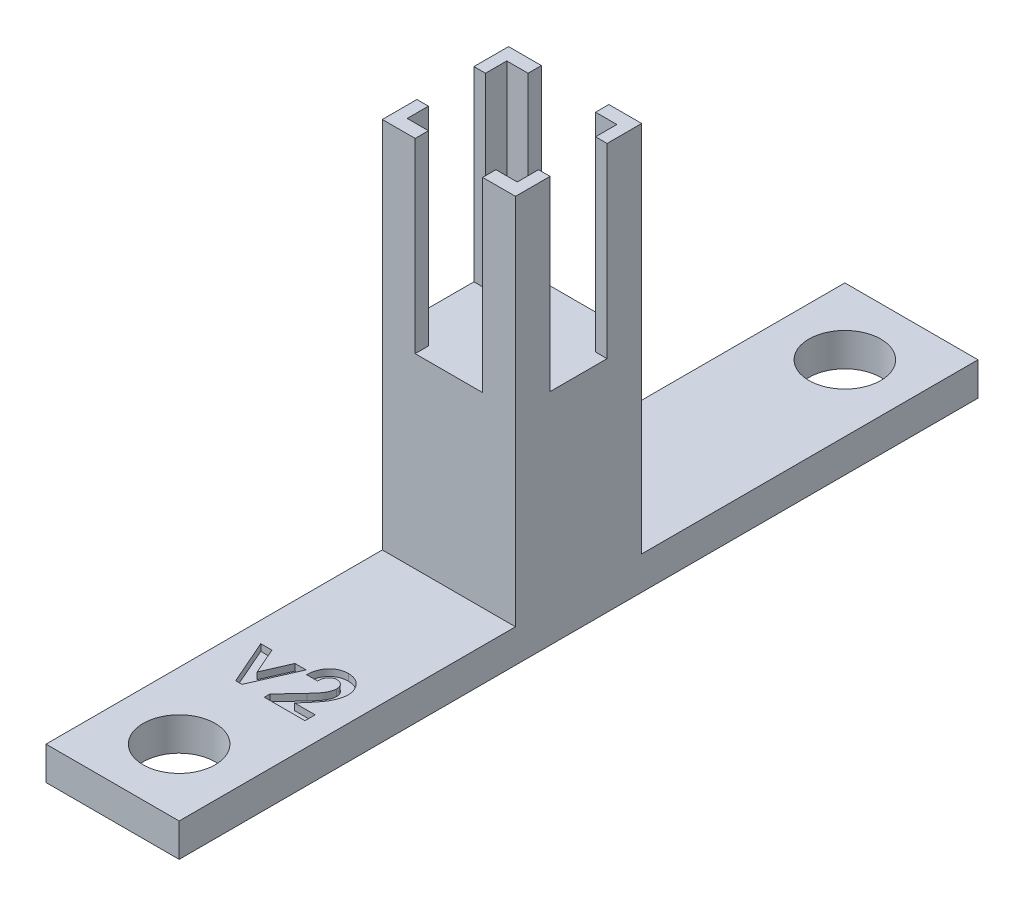
from build123d import *

# Parameters (mm, degrees)
BOSS_EXTRUDE1_DEPTH   = 17.78
BOSS_EXTRUDE1_2_DEPTH = 17.78
BOSS_EXTRUDE1_3_DEPTH = 17.78
BOSS_EXTRUDE1_4_DEPTH = 17.78
SKETCH2_W             = 13.04
SKETCH2_H             = 12.04
BOSS_EXTRUDE2_DEPTH   = 17.78
SKETCH3_W             = 12.7
SKETCH3_H             = 76.2
SKETCH3_R             = 3.429
BOSS_EXTRUDE3_DEPTH   = 3.175
SKETCH4_OUTSIDE_W     = 32.334
SKETCH4_OUTSIDE_H     = 95.494
SKETCH4_OUTSIDE_W_2   = 12.7
SKETCH4_OUTSIDE_H_2   = 76.2
CUT_EXTRUDE2_DEPTH    = 55.722213268
CUT_EXTRUDE3_DEPTH    = 0.635


with BuildPart() as part:
    # Sketch1 → Boss-Extrude1 (new body)
    with BuildSketch(Plane(origin=(0, 0, 0), x_dir=(1, 0, 0), z_dir=(0, 1, 0))):
        Polygon((-5.25, 4.75), (-5.25, 2.718), (-6.52, 2.718), (-6.52, 6.02), (-3.218, 6.02), (-3.218, 4.75), align=None)
    extrude(amount=BOSS_EXTRUDE1_DEPTH)



with BuildPart() as body_2:
    # Sketch1 → Boss-Extrude1 2 (new body)
    with BuildSketch(Plane(origin=(0, 0, 0), x_dir=(1, 0, 0), z_dir=(0, 1, 0))):
        Polygon((6.52, 2.718), (6.52, 6.02), (3.218, 6.02), (3.218, 4.75), (5.25, 4.75), (5.25, 2.718), align=None)
    extrude(amount=BOSS_EXTRUDE1_2_DEPTH)


with BuildPart() as body_3:
    # Sketch1 → Boss-Extrude1 3 (new body)
    with BuildSketch(Plane(origin=(0, 0, 0), x_dir=(1, 0, 0), z_dir=(0, 1, 0))):
        Polygon((5.25, -2.718), (6.52, -2.718), (6.52, -6.02), (3.218, -6.02), (3.218, -4.75), (5.25, -4.75), align=None)
    extrude(amount=BOSS_EXTRUDE1_3_DEPTH)


with BuildPart() as body_4:
    # Sketch1 → Boss-Extrude1 4 (new body)
    with BuildSketch(Plane(origin=(0, 0, 0), x_dir=(1, 0, 0), z_dir=(0, 1, 0))):
        Polygon((-5.25, -2.718), (-6.52, -2.718), (-6.52, -6.02), (-3.218, -6.02), (-3.218, -4.75), (-5.25, -4.75), align=None)
    extrude(amount=BOSS_EXTRUDE1_4_DEPTH)


with BuildPart() as part_1:
    add(part.part)

    add(body_2.part)  # Boss-Extrude2 merges body 2

    add(body_3.part)  # Boss-Extrude2 merges body 3

    add(body_4.part)  # Boss-Extrude2 merges body 4
    # Sketch2 → Boss-Extrude2 (add)
    with BuildSketch(Plane(origin=(0, 0, 0), x_dir=(-1, 0, 0), z_dir=(0, -1, 0))):
        Rectangle(SKETCH2_W, SKETCH2_H)
    extrude(amount=BOSS_EXTRUDE2_DEPTH)

    # Sketch3 → Boss-Extrude3 (add)
    with BuildSketch(Plane(origin=(0, -17.78, 0), x_dir=(-1, 0, 0), z_dir=(0, -1, 0))):
        Rectangle(SKETCH3_W, SKETCH3_H)
        with Locations(Location((0, 31.75, 0), (0, 0, 90))):
            Circle(SKETCH3_R, mode=Mode.SUBTRACT)
        with Locations(Location((0, -31.75, 0), (0, 0, 270))):
            Circle(SKETCH3_R, mode=Mode.SUBTRACT)
    extrude(amount=BOSS_EXTRUDE3_DEPTH)

    # Sketch4 outside → Cut-Extrude2 (cut, through all)
    with BuildSketch(Plane.XZ.offset(20.955)):
        Rectangle(SKETCH4_OUTSIDE_W, SKETCH4_OUTSIDE_H)
        Rectangle(SKETCH4_OUTSIDE_W_2, SKETCH4_OUTSIDE_H_2, mode=Mode.SUBTRACT)
    extrude(amount=-CUT_EXTRUDE2_DEPTH, mode=Mode.SUBTRACT)

    # Sketch5 → Cut-Extrude3 (cut)
    with BuildSketch(Plane(origin=(0, -17.78, 0), x_dir=(1, 0, 0), z_dir=(0, 1, 0))):
        Polygon((-4.402938034, -19.56265828), (-3.33951656, -19.56265828), (-2.238782051, -22.073125862), (-1.138047543, -19.56265828), (-0.074626068, -19.56265828), (-1.937945713, -23.816344178), (-2.539618389, -23.816344178), align=None)
        with BuildLine():
            Line((1.380582265, -19.935788622), (0.335817308, -19.935788622))
            add(Edge.make_bspline(
                [(0.335817308, -19.935788622), (0.340329487, -19.85675768), (0.349146015, -19.702335965), (0.384215936, -19.478033479), (0.431208425, -19.266092295), (0.493926141, -19.067253807), (0.572735055, -18.881590265), (0.665607209, -18.708468733), (0.774915278, -18.5488007), (0.898332826, -18.403356174), (1.033764562, -18.272876548), (1.17839879, -18.157185114), (1.334447887, -18.061719455), (1.499060707, -17.983160056), (1.672209219, -17.920394746), (1.855531682, -17.878431057), (2.04744079, -17.850012836), (2.178818114, -17.847526128), (2.245778245, -17.846258707)],
                knots=[0, 0, 0, 0, 1.199038563, 2.342849363, 3.436047546, 4.486744587, 5.497670872, 6.488682221, 7.459191391, 8.424610317, 9.374430501, 10.305433194, 11.225809216, 12.140057399, 13.06607119, 14.010487599, 14.985989317, 16, 16, 16, 16], degree=3))
            add(Edge.make_bspline(
                [(2.245778245, -17.846258707), (2.327970856, -17.848823334), (2.488430093, -17.853830085), (2.721590093, -17.896539334), (2.93933604, -17.967977154), (3.141509653, -18.067794628), (3.326389793, -18.194602266), (3.493945801, -18.34579962), (3.639110517, -18.52455889), (3.762804328, -18.723442196), (3.865579101, -18.934031626), (3.937599381, -19.151789829), (3.984937536, -19.370938387), (3.989986444, -19.518501933), (3.992494658, -19.591809088)],
                knots=[0, 0, 0, 0, 1.075374347, 2.099382735, 3.09057751, 4.06680945, 5.040638231, 6.016817125, 7.011024321, 8.044445721, 9.0776792, 10.070479129, 11.0414456, 12, 12, 12, 12], degree=3))
            add(Edge.make_bspline(
                [(3.992494658, -19.591809088), (3.991518092, -19.636150437), (3.989552505, -19.725398619), (3.97588552, -19.860453023), (3.955382341, -19.998021723), (3.924468545, -20.137986768), (3.885916506, -20.280387391), (3.839147311, -20.425649748), (3.783076101, -20.572950255), (3.718638592, -20.723946755), (3.641764481, -20.879129473), (3.552255264, -21.04082466), (3.447735164, -21.208888878), (3.329466651, -21.384271073), (3.196875325, -21.566694641), (3.049313917, -21.755610064), (2.888481989, -21.95168302), (2.774335046, -22.082746787), (2.715689269, -22.150083995)],
                knots=[0, 0, 0, 0, 0.728284026, 1.46585585, 2.227944881, 3.01186502, 3.81876927, 4.650621989, 5.517437689, 6.406905708, 7.346299482, 8.360816762, 9.441613733, 10.596154504, 11.834900912, 13.145207542, 14.533280747, 16, 16, 16, 16], degree=3))
            Line((2.715689269, -22.150083995), (2.108186432, -22.846205289))
            Line((2.108186432, -22.846205289), (4.067120726, -22.846205289))
            Line((4.067120726, -22.846205289), (4.067120726, -23.816344178))
            Line((4.067120726, -23.816344178), (0.186565171, -23.816344178))
            Line((0.186565171, -23.816344178), (0.186565171, -23.286965505))
            Line((0.186565171, -23.286965505), (1.909960938, -21.452796668))
            add(Edge.make_bspline(
                [(1.909960938, -21.452796668), (1.959857674, -21.399293394), (2.056492855, -21.295673418), (2.193994758, -21.143496459), (2.318421835, -20.999084157), (2.427193988, -20.860898814), (2.526019439, -20.733422598), (2.610491571, -20.612813217), (2.681383236, -20.500161025), (2.758346193, -20.364322155), (2.831435702, -20.202310131), (2.898499751, -20.015665636), (2.93937993, -19.837276484), (2.945022687, -19.721034278), (2.947729701, -19.665269124)],
                knots=[0, 0, 0, 0, 1.246127091, 2.413378631, 3.493388633, 4.492180848, 5.408488754, 6.240484944, 6.999099869, 7.674939598, 8.898438119, 10.020720584, 11.050475521, 12, 12, 12, 12], degree=3))
            add(Edge.make_bspline(
                [(2.947729701, -19.665269124), (2.945705732, -19.611320641), (2.941783968, -19.506786804), (2.898686962, -19.358087978), (2.831919585, -19.223456371), (2.737834921, -19.106914927), (2.623868926, -19.011145094), (2.492170513, -18.939914183), (2.343813413, -18.898814274), (2.239812259, -18.893670033), (2.186310597, -18.891023665)],
                knots=[0, 0, 0, 0, 1.062038974, 2.057870785, 3.028805853, 4.01125022, 4.991535629, 5.949134679, 6.94496649, 8, 8, 8, 8], degree=3))
            add(Edge.make_bspline(
                [(2.186310597, -18.891023665), (2.158670957, -18.892001265), (2.104257887, -18.893925828), (2.024274927, -18.906737125), (1.948165395, -18.929315698), (1.875082148, -18.959567808), (1.80580515, -18.999667197), (1.740509141, -19.049096083), (1.678506143, -19.106598364), (1.620080529, -19.17199424), (1.566905592, -19.244976057), (1.519675807, -19.324877276), (1.480624638, -19.411648298), (1.44624257, -19.504143614), (1.419725473, -19.603356699), (1.400417737, -19.708693775), (1.385739355, -19.819983471), (1.382332567, -19.896484672), (1.380582265, -19.935788622)],
                knots=[0, 0, 0, 0, 0.903469896, 1.778625579, 2.63899355, 3.493148037, 4.358286772, 5.247621495, 6.164656832, 7.118446693, 8.109501108, 9.111810964, 10.146451449, 11.215617525, 12.33435995, 13.498009769, 14.714554818, 16, 16, 16, 16], degree=3))
        make_face()
    extrude(amount=-CUT_EXTRUDE3_DEPTH, mode=Mode.SUBTRACT)


solid = part_1.part
